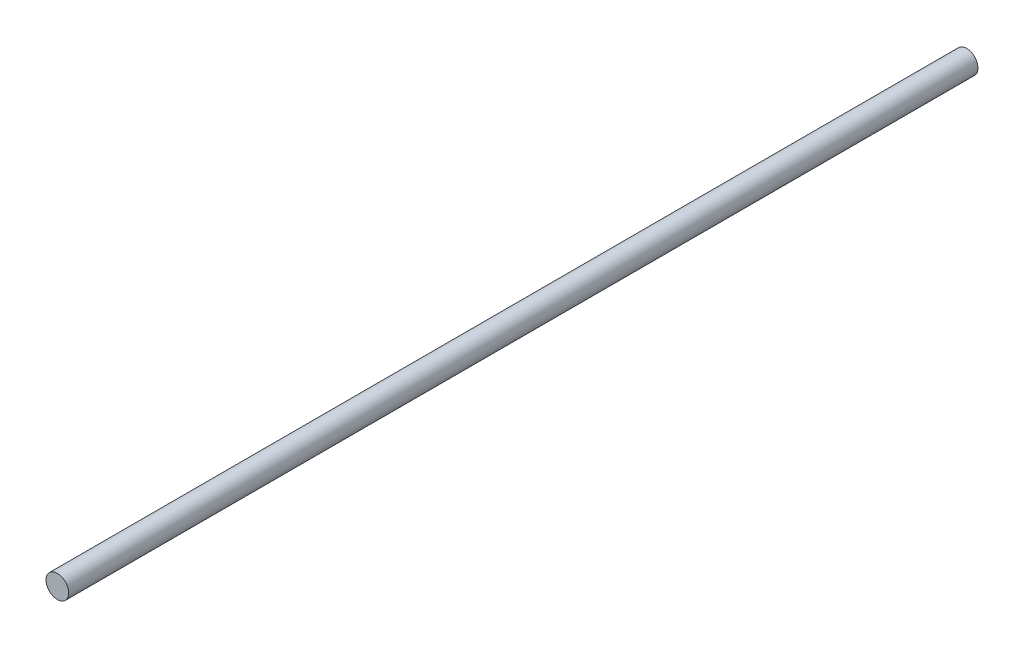
from build123d import *

# Parameters (mm, degrees)
SKETCH_1_R      = 2.5
EXTRUDE_1_DEPTH = 200


with BuildPart() as part:
    # 草图1 → 凸台-拉伸1 (new body)
    with BuildSketch(Plane.XY):
        Circle(SKETCH_1_R)
    extrude(amount=EXTRUDE_1_DEPTH)


solid = part.part
